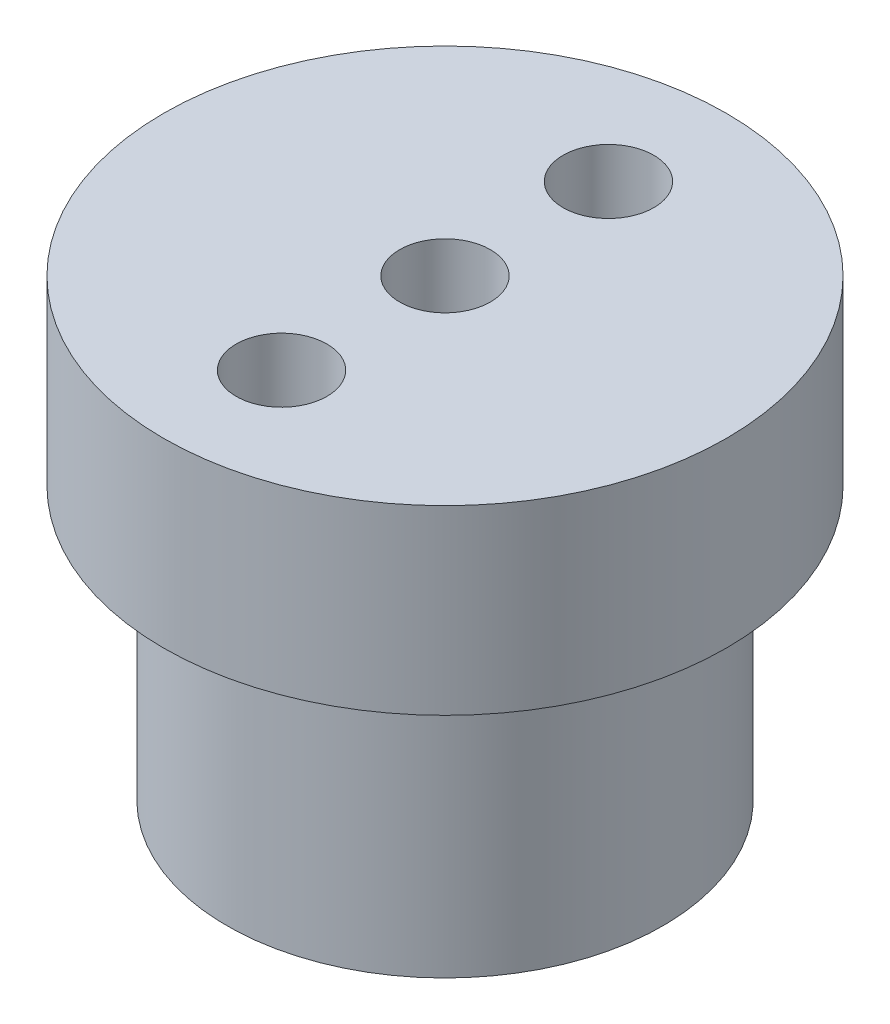
from build123d import *

# Parameters (mm, degrees)
ESQUISSE2_R             = 1.25
ENL_V_MAT_EXTRU_1_DEPTH = 10


with BuildPart() as part:
    # Esquisse1 → Révolution1 (revolve)
    with BuildSketch(Plane.XY, mode=Mode.PRIVATE) as r_volution1_sk:
        Polygon((7.75, 12.5), (7.75, 7.5), (6, 7.5), (6, 0), (1.25, 0), (1.25, 12.5), align=None)
    revolve(r_volution1_sk.sketch.rotate(Axis((0, 0, 0), (0, 1, 0)), 90), axis=Axis((0, 0, 0), (0, 1, 0)))

    # Esquisse2 → Enlèv. mat.-Extru.1 (cut)
    with BuildSketch(Plane(origin=(0, 12.5, 0), x_dir=(1, 0, 0), z_dir=(0, 1, 0))):
        with Locations(Location((0, 4.5, 0), (0, 0, 270))):
            Circle(ESQUISSE2_R)
        with Locations(Location((0, -4.5, 0), (0, 0, 90))):
            Circle(ESQUISSE2_R)
    extrude(amount=-ENL_V_MAT_EXTRU_1_DEPTH, mode=Mode.SUBTRACT)


solid = part.part
